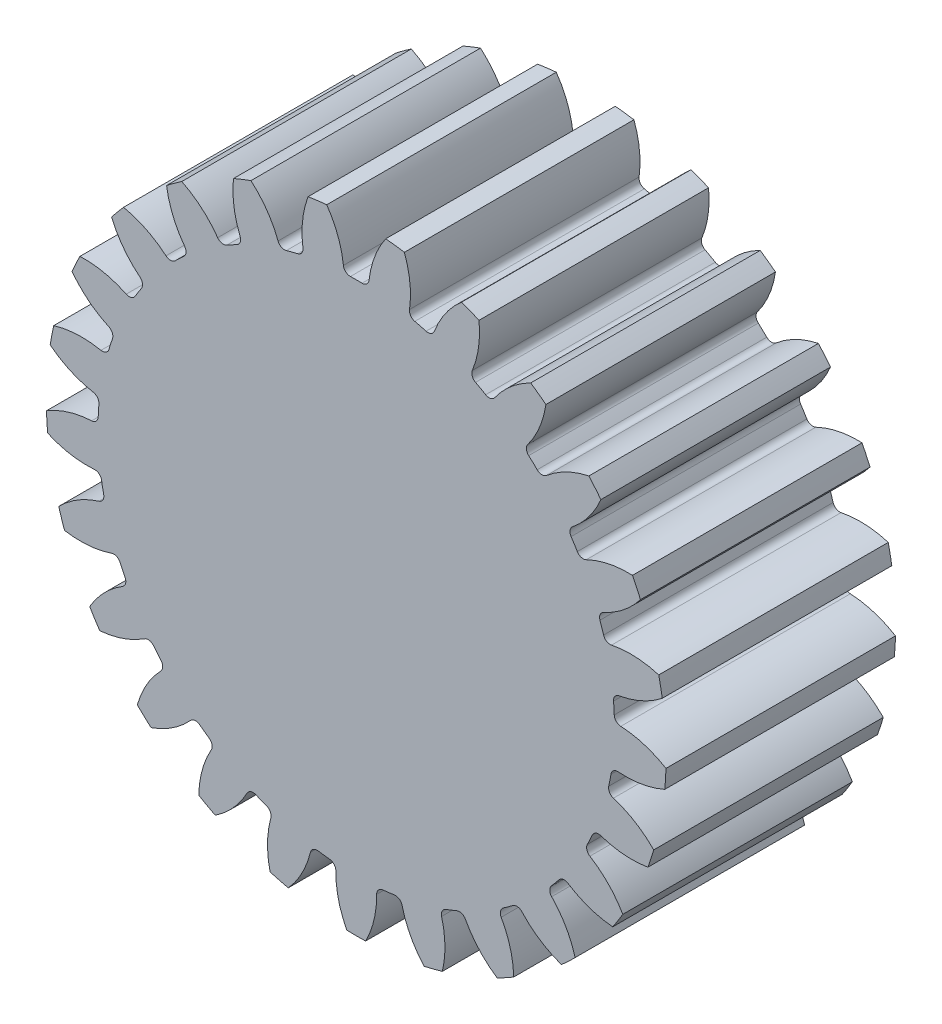
from build123d import *

# Parameters (mm, degrees)
SKETCH1_R                = 27
SKETCH1_R_2              = 25
SKETCH1_R_3              = 22.5
BOSS_EXTRUDE1_DEPTH      = 10
CUT_EXTRUDE2_DEPTH       = 40.471508712
FILLET1_R                = 0.6
CIRPATTERN1_COUNT        = 25
FILLET1_OF_CIRPATTERN1_R = 0.6
SCALE1_SCALE             = 0.6


with BuildPart() as part:
    # Sketch1 → Boss-Extrude1 (new, symmetric)
    # profile 1 of 3: a face of its own
    with BuildSketch(Plane.XY):
        Circle(SKETCH1_R)
        Circle(SKETCH1_R_2, mode=Mode.SUBTRACT)
    # profile 2 of 3: a face of its own
    with BuildSketch(Plane.XY):
        Circle(SKETCH1_R_2)
        Circle(SKETCH1_R_3, mode=Mode.SUBTRACT)
    # profile 3 of 3: a face of its own
    with BuildSketch(Plane.XY):
        Circle(SKETCH1_R_3)
    extrude(amount=BOSS_EXTRUDE1_DEPTH, both=True)

    # Sketch2 → Cut-Extrude2 (cut, symmetric)
    with BuildSketch(Plane.XY):
        with BuildLine():
            ThreePointArc((2.569085244, 26.877496182), (0, 27), (-2.569085244, 26.877496182))
            ThreePointArc((-2.569085244, 26.877496182), (-1.510220721, 24.781486697), (-1.072022538, 22.474446994))
            ThreePointArc((-1.072022538, 22.474446994), (0, 22.5), (1.072022538, 22.474446994))
            ThreePointArc((1.072022538, 22.474446994), (1.510220721, 24.781486697), (2.569085244, 26.877496182))
        make_face()
    cut_extrude2 = extrude(amount=CUT_EXTRUDE2_DEPTH, both=True, mode=Mode.SUBTRACT)

    # Fillet1
    fillet1_edges = [part.edges().sort_by_distance(p)[0] for p in [
        (-1.072022538, 22.474446994, 0),
        (1.072022538, 22.474446994, 0),
    ]]
    fillet(fillet1_edges, radius=FILLET1_R)

    # CirPattern1: Cut-Extrude2 ×25 about axis
    cirpattern1_axis = Axis((0, 0, 0), (0, 0, 1))
    for i in range(1, CIRPATTERN1_COUNT):
        add(cut_extrude2.rotate(cirpattern1_axis, i * 360 / CIRPATTERN1_COUNT), mode=Mode.SUBTRACT)

    # Fillet1 of CirPattern1
    fillet1_of_cirpattern1_edges = [part.edges().sort_by_distance(p)[0] for p in [
        (-6.627510666, 21.50176975, 0),
        (-4.550824708, 22.034972078, 0),
        (-11.766567924, 19.178057235, 0),
        (-9.887726902, 20.210958827, 0),
        (-16.166288445, 15.649316851, 0),
        (-14.603346849, 17.117016703, 0),
        (-19.550221608, 11.137272336, 0),
        (-18.401384806, 12.947549467, 0),
        (-21.705742446, 5.92543204, 0),
        (-21.043196081, 7.964540081, 0),
        (-22.497411659, 0.341275057, 0),
        (-22.362785954, 2.481089349, 0),
        (-21.875485757, -5.264325494, 0),
        (-22.277239742, -3.158257351, 0),
        (-19.879042632, -10.539149113, 0),
        (-20.791932626, -8.599159126, 0),
        (-16.63352615, -15.151759232, 0),
        (-18.000191916, -13.499744108, 0),
        (-12.342864045, -18.812328595, 0),
        (-14.077432948, -17.552090519, 0),
        (-7.276654398, -21.290850165, 0),
        (-9.270137095, -20.501574531, 0),
        (-1.753225794, -22.431589318, 0),
        (-3.880364434, -22.162869215, 0),
        (3.880364434, -22.162869215, 0),
        (1.753225794, -22.431589318, 0),
        (9.270137095, -20.501574531, 0),
        (7.276654398, -21.290850165, 0),
        (14.077432948, -17.552090519, 0),
        (12.342864045, -18.812328595, 0),
        (18.000191916, -13.499744108, 0),
        (16.63352615, -15.151759232, 0),
        (20.791932626, -8.599159126, 0),
        (19.879042632, -10.539149113, 0),
        (22.277239742, -3.158257351, 0),
        (21.875485757, -5.264325494, 0),
        (22.362785954, 2.481089349, 0),
        (22.497411659, 0.341275057, 0),
        (21.043196081, 7.964540081, 0),
        (21.705742446, 5.92543204, 0),
        (18.401384806, 12.947549467, 0),
        (19.550221608, 11.137272336, 0),
        (14.603346849, 17.117016703, 0),
        (16.166288445, 15.649316851, 0),
        (9.887726902, 20.210958827, 0),
        (11.766567924, 19.178057235, 0),
        (4.550824708, 22.034972078, 0),
        (6.627510666, 21.50176975, 0),
    ]]
    fillet(fillet1_of_cirpattern1_edges, radius=FILLET1_OF_CIRPATTERN1_R)


with BuildPart() as part_1:
    # Scale1: scaled about (0, 0, 0)
    add(part.part.scale(SCALE1_SCALE))


solid = part_1.part
